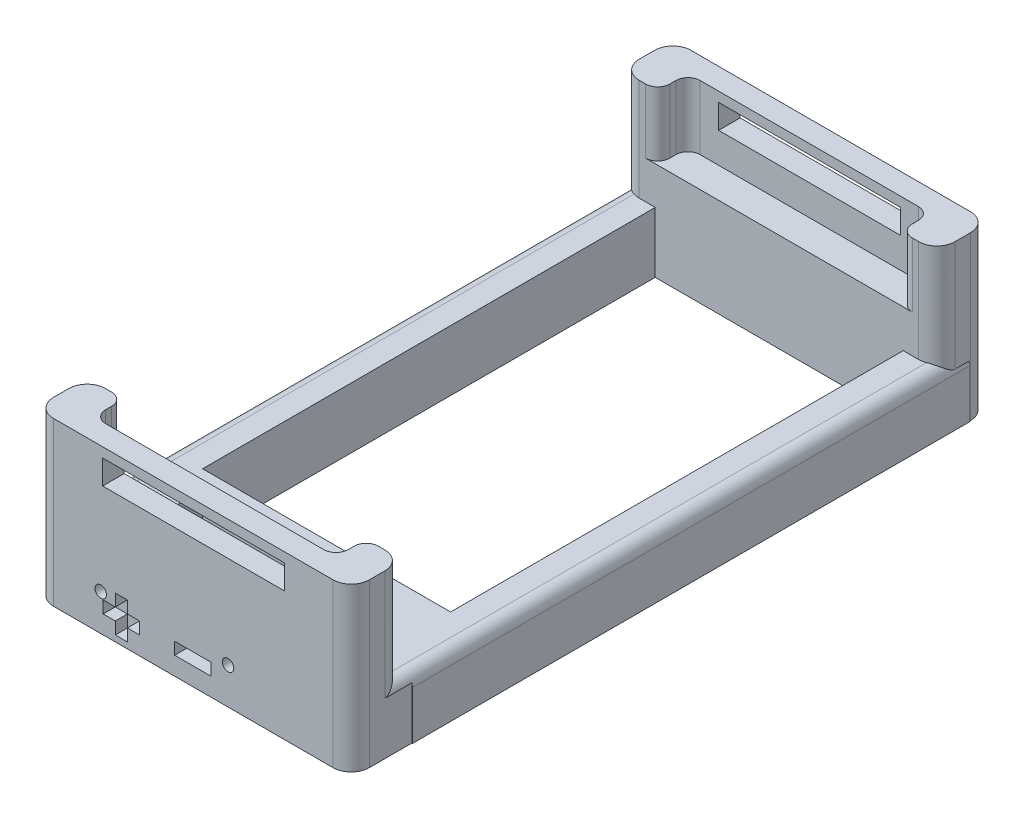
from build123d import *

# Parameters (mm, degrees)
SKETCH_1_W               = 52.13
SKETCH_1_H               = 16.25
SKETCH_1_R               = 0.95
EXTRUDE_1_DEPTH          = 10
SKETCH_2_W               = 7.1
SKETCH_2_H               = 10
EXTRUDE_2_DEPTH          = 11.95
EXTRUDE_3_DEPTH          = 10.6
SKETCH_4_W               = 30
SKETCH_4_H               = 4
CUT_EXTRUDE_1_DEPTH      = 11
SKETCH_6_W               = 5.65
SKETCH_6_H               = 10
EXTRUDE_4_DEPTH          = 80
CUT_EXTRUDE_2_DEPTH      = 80
CUT_EXTRUDE_2_DEPTH_BACK = 6.25
SKETCH_7_W               = 52.13
SKETCH_7_H               = 1.45
SKETCH_7_H_2             = 1.85
SKETCH_8_W               = 11.056524021
SKETCH_8_H               = 11.95
CUT_EXTRUDE_3_DEPTH      = 103.005836269
SKETCH_9_W               = 3.1
SKETCH_9_H               = 10
EXTRUDE_5_DEPTH          = 25.2
SKETCH_10_W              = 2
SKETCH_10_H              = 2
EXTRUDE_6_DEPTH          = 8.85
SKETCH_11_W              = 40.93148405
SKETCH_11_H              = 1.45
CUT_EXTRUDE_4_DEPTH      = 103.005836269
SKETCH_12_W              = 5.73041858
SKETCH_12_H              = 11.95
EXTRUDE_7_DEPTH          = 10
FILLET_1_R               = 3
FILLET_2_R               = 2
SKETCH_13_R              = 1.05
CUT_EXTRUDE_5_DEPTH      = 105.087334213
FILLET_3_R               = 2
SKETCH_14_R              = 0.95
EXTRUDE_8_DEPTH          = 3.4
SKETCH_15_W              = 23.6
SKETCH_15_H              = 5.45
SKETCH_15_W_2            = 1.6
EXTRUDE_9_DEPTH          = 10
SKETCH_15_3_W            = 23.6
SKETCH_15_3_H            = 5.45
SKETCH_15_3_W_2          = 1.6
CUT_EXTRUDE_6_DEPTH      = 103.005836318
SKETCH_16_W              = 2
SKETCH_16_H              = 5.45
EXTRUDE_10_DEPTH         = 2
EXTRUDE_START            = -13.4
SKETCH_17_R              = 0.95
EXTRUDE_11_DEPTH         = 13.4
SKETCH_17_4_R            = 0.95
SKETCH_17_4_R_2          = 1.05
EXTRUDE_12_DEPTH         = 8.55
CUT_EXTRUDE_7_REACH      = 114.071
SKETCH_18_R              = 0.95
SKETCH_19_R              = 0.95
EXTRUDE_13_DEPTH         = 8.55
SKETCH_20_W              = 6
SKETCH_20_H              = 2
SKETCH_20_W_2            = 2
SKETCH_20_H_2            = 6
CUT_EXTRUDE_1_2_DEPTH    = 2
SKETCH_21_W              = 6
SKETCH_21_H              = 2
SKETCH_21_W_2            = 2
SKETCH_21_H_2            = 6
CUT_EXTRUDE_2_2_DEPTH    = 2


with BuildPart() as part:
    # 草图1 → 凸台-拉伸1 (new body)
    with BuildSketch(Plane.XY):
        with Locations((6.365, 2.125)):
            Rectangle(SKETCH_1_W, SKETCH_1_H)
        with Locations((-10.5, 0)):
            Circle(SKETCH_1_R, mode=Mode.SUBTRACT)
        with Locations(Location((10.5, 0, 0), (0, 0, 180))):
            Circle(SKETCH_1_R, mode=Mode.SUBTRACT)
    extrude_1 = extrude(amount=EXTRUDE_1_DEPTH)

    # 草图2 → 凸台-拉伸2 (add)
    with BuildSketch(Plane(origin=(0, 0, 0), x_dir=(-1, 0, 0), z_dir=(0, 0, -1))):
        with Locations((16.15, -1)):
            Rectangle(SKETCH_2_W, SKETCH_2_H)
        with Locations((-16.15, -1)):
            Rectangle(SKETCH_2_W, SKETCH_2_H)
    extrude_2 = extrude(amount=EXTRUDE_2_DEPTH)

    # 草图3 → 凸台-拉伸3 (add)
    with BuildSketch(Plane(origin=(0, 10.25, 0), x_dir=(1, 0, 0), z_dir=(0, 1, 0))):
        Polygon((32.43, -10), (-19.7, -10), (-19.7, -1.45), (-13.635, -1.45), (-13.635, -6.45), (26.365, -6.45), (26.365, -1.45), (32.43, -1.45), align=None)
    extrude_3 = extrude(amount=EXTRUDE_3_DEPTH)

    # 草图4 → Cut-Extrude 1 (cut)
    with BuildSketch(Plane.XY.offset(10)):
        with Locations((6.41520929, 17.24732554)):
            Rectangle(SKETCH_4_W, SKETCH_4_H)
    cut_extrude_1 = extrude(amount=-CUT_EXTRUDE_1_DEPTH, mode=Mode.SUBTRACT)

    # 草图6 → 凸台-拉伸4 (add)
    with BuildSketch(Plane(origin=(0, 0, -11.95), x_dir=(-1, 0, 0), z_dir=(0, 0, -1))):
        with Locations((16.875, -1)):
            Rectangle(SKETCH_6_W, SKETCH_6_H)
    extrude_4 = extrude(amount=EXTRUDE_4_DEPTH)

    # 镜向1: 凸台-拉伸2, 凸台-拉伸4 across plane
    add(extrude_2.mirror(Plane.ZY.offset(-6.41520929)))
    add(extrude_4.mirror(Plane.ZY.offset(-6.41520929)))

    # 镜向2: 凸台-拉伸1, 凸台-拉伸3, Cut-Extrude 1 across plane
    add(extrude_1.mirror(Plane.XY.offset(-42.6)))
    add(extrude_3.mirror(Plane.XY.offset(-42.6)))
    add(cut_extrude_1.mirror(Plane.XY.offset(-42.6)), mode=Mode.SUBTRACT)

    # 草图7 → Cut-Extrude 2 (cut, two sides: drawn at the far end of the back side and taken through both)
    with BuildSketch(Plane(origin=(0, 10.25, 0), x_dir=(1, 0, 0), z_dir=(0, 1, 0)).offset(-CUT_EXTRUDE_2_DEPTH_BACK)):
        with Locations((6.365, -0.725)):
            Rectangle(SKETCH_7_W, SKETCH_7_H)
        with Locations((6.365, 85.725)):
            Rectangle(SKETCH_7_W, SKETCH_7_H_2)
    extrude(amount=CUT_EXTRUDE_2_DEPTH + CUT_EXTRUDE_2_DEPTH_BACK, mode=Mode.SUBTRACT)

    # 草图8 → 切除-拉伸3 (cut, through all)
    with BuildSketch(Plane(origin=(0, 4, 0), x_dir=(1, 0, 0), z_dir=(0, 1, 0))):
        with Locations((-1.34131941, 5.975)):
            Rectangle(SKETCH_8_W, SKETCH_8_H)
    extrude(amount=-CUT_EXTRUDE_3_DEPTH, mode=Mode.SUBTRACT)

    # 草图9 → 凸台-拉伸5 (add)
    with BuildSketch(Plane.ZY.offset(-12.6)):
        with Locations((-10.4, -1)):
            Rectangle(SKETCH_9_W, SKETCH_9_H)
    extrude(amount=EXTRUDE_5_DEPTH)

    # 草图10 → 凸台-拉伸6 (add)
    with BuildSketch(Plane(origin=(0, 0, 0), x_dir=(-1, 0, 0), z_dir=(0, 0, -1))):
        with Locations((-11.6, -5)):
            Rectangle(SKETCH_10_W, SKETCH_10_H)
        with Locations((11.6, -5)):
            Rectangle(SKETCH_10_W, SKETCH_10_H)
    extrude(amount=EXTRUDE_6_DEPTH)

    # 草图11 → 切除-拉伸4 (cut, through all)
    with BuildSketch(Plane(origin=(0, 4, 0), x_dir=(1, 0, 0), z_dir=(0, 1, 0))):
        with Locations((6.415742025, 85.925)):
            Rectangle(SKETCH_11_W, SKETCH_11_H)
    extrude(amount=-CUT_EXTRUDE_4_DEPTH, mode=Mode.SUBTRACT)

    # 草图12 → 凸台-拉伸7 (add)
    with BuildSketch(Plane(origin=(0, 4, 0), x_dir=(1, 0, 0), z_dir=(0, 1, 0))):
        with Locations((22.56520929, 5.975)):
            Rectangle(SKETCH_12_W, SKETCH_12_H)
    extrude(amount=-EXTRUDE_7_DEPTH)

    # 圆角1
    fillet_1_edges = [part.edges().sort_by_distance(p)[0] for p in [
        (32.43, 7.425, 10),
        (-19.7, 7.425, -95.2),
        (32.43, 7.425, -95.2),
        (-19.7, 12.425, -86.65),
        (32.43, 12.425, -86.65),
        (-19.7, 7.425, 10),
        (-19.7, 12.425, 1.45),
        (32.43, 12.425, 1.45),
    ]]
    fillet(fillet_1_edges, radius=FILLET_1_R)

    # 圆角2
    fillet_2_edges = [part.edges().sort_by_distance(p)[0] for p in [
        (32.53041858, 4, -45.975),
        (-19.7, 4, -42.6),
    ]]
    fillet(fillet_2_edges, radius=FILLET_2_R)

    # 草图13 → 切除-拉伸5 (cut, through all)
    with BuildSketch(Plane(origin=(0, 0, 1.45), x_dir=(-1, 0, 0), z_dir=(0, 0, -1))):
        with Locations((0, 5.05)):
            Circle(SKETCH_13_R)
    extrude(amount=-CUT_EXTRUDE_5_DEPTH, mode=Mode.SUBTRACT)

    # 圆角3
    fillet_3_edges = [part.edges().sort_by_distance(p)[0] for p in [
        (-13.635, 15.55, -86.65),
        (-13.635, 15.55, -91.65),
        (26.365, 15.55, -91.65),
        (26.365, 15.55, -86.65),
        (26.365, 15.55, 1.45),
        (26.365, 15.55, 6.45),
        (-13.635, 15.55, 6.45),
        (-13.635, 15.55, 1.45),
    ]]
    fillet(fillet_3_edges, radius=FILLET_3_R)

    # 草图14 → 凸台-拉伸8 (add)
    with BuildSketch(Plane(origin=(0, 0, 0), x_dir=(-1, 0, 0), z_dir=(0, 0, -1))):
        Polygon((10.6, -4), (12.6, -4), (12.6, 4), (-12.6, 4), (-12.6, -4), (-10.6, -4), (-10.6, -6), (10.6, -6), align=None)
        with Locations((-10.5, 0)):
            Circle(SKETCH_14_R, mode=Mode.SUBTRACT)
        with Locations((10.5, 0)):
            Circle(SKETCH_14_R, mode=Mode.SUBTRACT)
    extrude(amount=EXTRUDE_8_DEPTH)

    # 草图15 → 凸台-拉伸9 (add, through all)
    with BuildSketch(Plane(origin=(0, 4, 0), x_dir=(1, 0, 0), z_dir=(0, 1, 0))):
        with Locations((0.8, 6.125)):
            Rectangle(SKETCH_15_W, SKETCH_15_H)
        with Locations((-11.8, 6.125)):
            Rectangle(SKETCH_15_W_2, SKETCH_15_H)
        with Locations((13.4, 6.125)):
            Rectangle(SKETCH_15_W_2, SKETCH_15_H)
    extrude(amount=-EXTRUDE_9_DEPTH)

    # 草图15<3> → 切除-拉伸6 (cut, through all)
    with BuildSketch(Plane(origin=(0, 4, 0), x_dir=(1, 0, 0), z_dir=(0, 1, 0))):
        with Locations((0.8, 6.125)):
            Rectangle(SKETCH_15_3_W, SKETCH_15_3_H)
        with Locations((13.4, 6.125)):
            Rectangle(SKETCH_15_3_W_2, SKETCH_15_3_H)
    extrude(amount=-CUT_EXTRUDE_6_DEPTH, mode=Mode.SUBTRACT)

    # 草图16 → 凸台-拉伸10 (add)
    with BuildSketch(Plane(origin=(0, -6, 0), x_dir=(-1, 0, 0), z_dir=(0, -1, 0))):
        with Locations((10, 6.125)):
            Rectangle(SKETCH_16_W, SKETCH_16_H)
        with Locations((-13.2, 6.125)):
            Rectangle(SKETCH_16_W, SKETCH_16_H)
    extrude(amount=-EXTRUDE_10_DEPTH)

    # 草图17 → 凸台-拉伸11 (add)
    with BuildSketch(Plane.XY.offset(10).offset(EXTRUDE_START)):
        with Locations((-10.5, 0)):
            Circle(SKETCH_17_R)
        with Locations(Location((10.5, 0, 0), (0, 0, 180))):
            Circle(SKETCH_17_R)
    extrude(amount=EXTRUDE_11_DEPTH)

    # 草图17<4> → 凸台-拉伸12 (add)
    with BuildSketch(Plane.XY.offset(10)):
        with Locations(Location((10.5, 0, 0), (0, 0, 180))):
            Circle(SKETCH_17_4_R)
        with Locations((0, 5.05)):
            Circle(SKETCH_17_4_R_2)
        with Locations((-10.5, 0)):
            Circle(SKETCH_17_4_R)
    extrude(amount=-EXTRUDE_12_DEPTH)

    # 草图18 → 切除-拉伸7 (cut, up to next)
    with BuildSketch(Plane.XY.offset(10), mode=Mode.PRIVATE) as cut_extrude_7_sk1:
        with Locations((12.1, 0)):
            Circle(SKETCH_18_R)
    cut_extrude_7_tool1 = extrude(cut_extrude_7_sk1.sketch, amount=-CUT_EXTRUDE_7_REACH, mode=Mode.PRIVATE) & part.part
    # 草图18 → 切除-拉伸7 (cut, up to next)
    with BuildSketch(Plane.XY.offset(10), mode=Mode.PRIVATE) as cut_extrude_7_sk2:
        with Locations((-8.9, 0)):
            Circle(SKETCH_18_R)
    cut_extrude_7_tool2 = extrude(cut_extrude_7_sk2.sketch, amount=-CUT_EXTRUDE_7_REACH, mode=Mode.PRIVATE) & part.part
    add(cut_extrude_7_tool1.solids().sort_by_distance((12.1, 0, 10))[0], mode=Mode.SUBTRACT)
    add(cut_extrude_7_tool2.solids().sort_by_distance((-8.9, 0, 10))[0], mode=Mode.SUBTRACT)

    # 草图19 → 凸台-拉伸13 (add, through all)
    with BuildSketch(Plane.XY.offset(-86.65)):
        with Locations((-10.5, 0)):
            Circle(SKETCH_19_R)
        with Locations((10.5, 0)):
            Circle(SKETCH_19_R)
    extrude(amount=-EXTRUDE_13_DEPTH)

    # 草图20 → Cut-Extrude 1 2 (cut)
    with BuildSketch(Plane.XZ.offset(6)):
        with Locations((-5.5, 1)):
            Rectangle(SKETCH_20_W, SKETCH_20_H)
        with Locations((-5.5, 1)):
            Rectangle(SKETCH_20_W_2, SKETCH_20_H_2)
        with Locations((6.5, 1)):
            Rectangle(SKETCH_20_W, SKETCH_20_H)
    extrude(amount=-CUT_EXTRUDE_1_2_DEPTH, mode=Mode.SUBTRACT)

    # 草图21 → Cut-Extrude 2 2 (cut)
    with BuildSketch(Plane.XY.offset(10)):
        with Locations((-5.5, -2)):
            Rectangle(SKETCH_21_W, SKETCH_21_H)
        with Locations((-5.5, -2)):
            Rectangle(SKETCH_21_W_2, SKETCH_21_H_2)
        with Locations((6.3, -2)):
            Rectangle(SKETCH_21_W, SKETCH_21_H)
    extrude(amount=-CUT_EXTRUDE_2_2_DEPTH, mode=Mode.SUBTRACT)


solid = part.part
